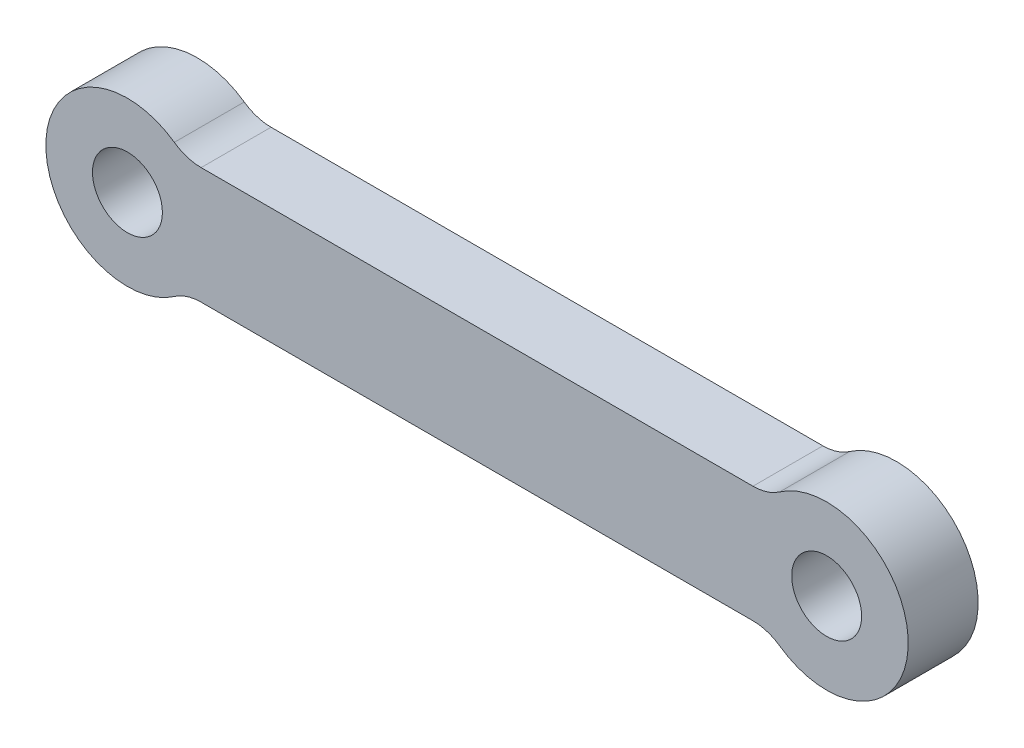
from build123d import *

# Parameters (mm, degrees)
SKETCH_1_R      = 1.5
EXTRUDE_1_DEPTH = 3


with BuildPart() as part:
    # 草图1 → 凸台-拉伸1 (new body)
    with BuildSketch(Plane.XY):
        with BuildLine():
            Line((3.16227766, 2.5), (26.83772234, 2.5))
            ThreePointArc((26.83772234, 2.5), (27.440745029, 2.593074822), (27.987641489, 2.863636364))
            ThreePointArc((27.987641489, 2.863636364), (33.5, 0), (27.987641489, -2.863636364))
            ThreePointArc((27.987641489, -2.863636364), (27.440745029, -2.593074822), (26.83772234, -2.5))
            Line((26.83772234, -2.5), (3.16227766, -2.5))
            ThreePointArc((3.16227766, -2.5), (2.559254971, -2.593074822), (2.012358511, -2.863636364))
            ThreePointArc((2.012358511, -2.863636364), (-3.5, 0), (2.012358511, 2.863636364))
            ThreePointArc((2.012358511, 2.863636364), (2.559254971, 2.593074822), (3.16227766, 2.5))
        make_face()
        Circle(SKETCH_1_R, mode=Mode.SUBTRACT)
        with Locations((30, 0)):
            Circle(SKETCH_1_R, mode=Mode.SUBTRACT)
    extrude(amount=EXTRUDE_1_DEPTH)


solid = part.part
